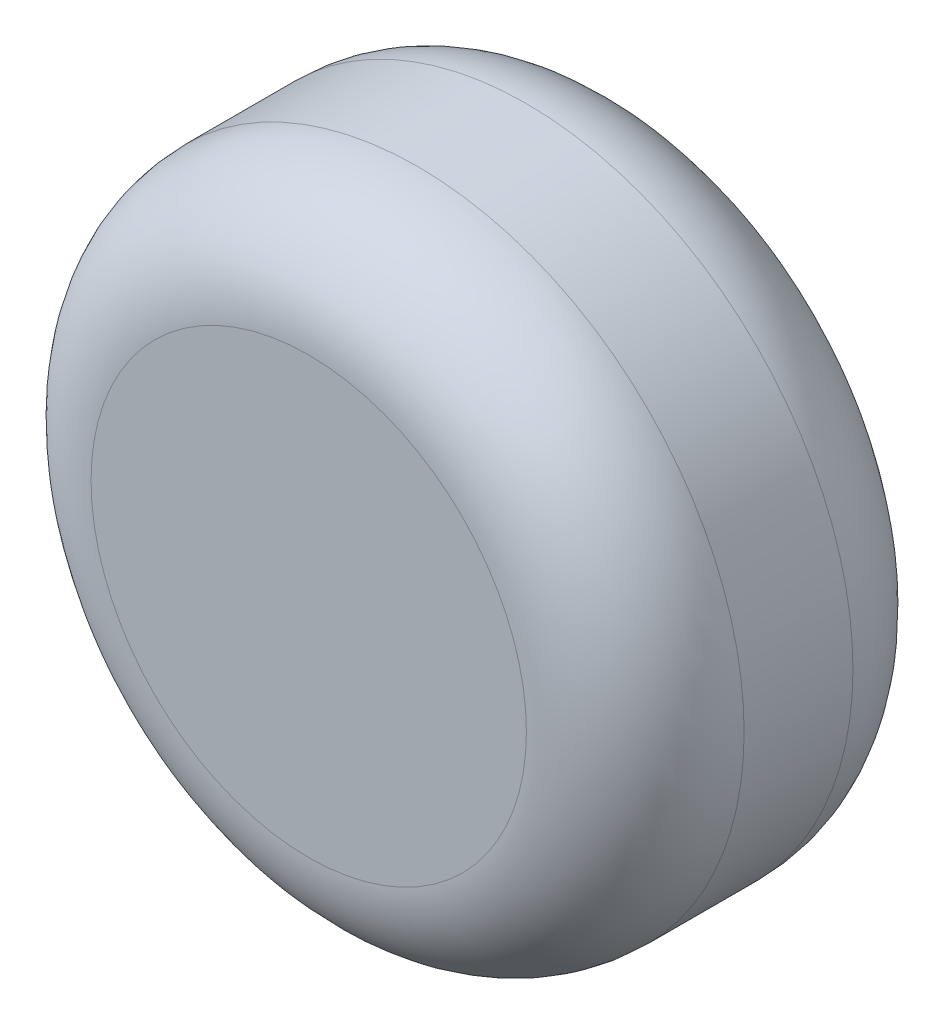
from build123d import *

# Parameters (mm, degrees)
ESQUISSE1_R        = 76.2
BOSS_EXTRU_1_DEPTH = 76.2
CONG_1_R           = 25.4


with BuildPart() as part:
    # Esquisse1 → Boss.-Extru.1 (new body)
    with BuildSketch(Plane.XY):
        with Locations(Location((0, 0, 0), (0, 0, 180))):
            Circle(ESQUISSE1_R)
    extrude(amount=BOSS_EXTRU_1_DEPTH)

    # Congé1
    cong_1_edges = [part.edges().sort_by_distance(p)[0] for p in [
        (76.2, 0, 0),
        (76.2, 0, 76.2),
    ]]
    fillet(cong_1_edges, radius=CONG_1_R)


solid = part.part
